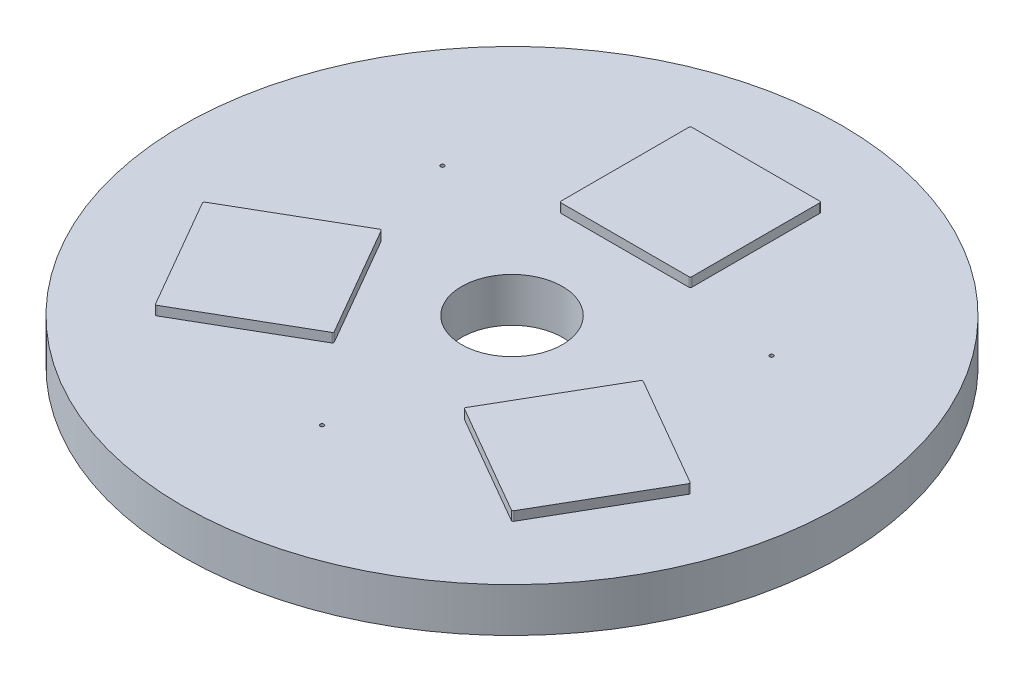
from build123d import *

# Parameters (mm, degrees)
SKETCH1_R            = 26.1
BOSS_EXTRUDE1_DEPTH  = 1.74625
SKETCH3_R            = 0.153555
SKETCH3_R_2          = 3.9925
CUT_EXTRUDE1_DEPTH   = 37.95225824
CIRPATTERN1_COUNT    = 3
BOSS_EXTRUDE2_DEPTH  = 0.727604167
CIRPATTERN2_COUNT    = 3
MIRROR1_COPY_1_DEPTH = 0.727604167
MIRROR1_COPY_2_DEPTH = 0.727604167


with BuildPart() as part:
    # Sketch1 → Boss-Extrude1 (new, symmetric)
    with BuildSketch(Plane(origin=(0, 0, 0), x_dir=(1, 0, 0), z_dir=(0, 1, 0))):
        with Locations(Location((0, 0, 0), (0, 0, 270))):
            Circle(SKETCH1_R)
    extrude(amount=BOSS_EXTRUDE1_DEPTH, both=True)

    # Sketch3 → Cut-Extrude1 (cut, symmetric)
    with BuildSketch(Plane(origin=(0, 0, 0), x_dir=(1, 0, 0), z_dir=(0, 1, 0))):
        with Locations(Location((0, -15.04625, 0), (0, 0, 270))):
            Circle(SKETCH3_R)
        with Locations(Location((0, 0, 0), (0, 0, 270))):
            Circle(SKETCH3_R_2)
    cut_extrude1 = extrude(amount=CUT_EXTRUDE1_DEPTH, both=True, mode=Mode.SUBTRACT)

    # CirPattern1: Cut-Extrude1 ×3 about axis
    cirpattern1_axis = Axis((0, 0, 0), (0, 1, 0))
    for i in range(1, CIRPATTERN1_COUNT):
        add(cut_extrude1.rotate(cirpattern1_axis, i * 360 / CIRPATTERN1_COUNT), mode=Mode.SUBTRACT)

    # Sketch5 → Boss-Extrude2 (add)
    with BuildSketch(Plane(origin=(0, 1.74625, 0), x_dir=(1, 0, 0), z_dir=(0, 1, 0))):
        with BuildLine():
            Line((-10.437704598, -0.043193858), (-19.210591569, -5.108222512))
            ThreePointArc((-19.210591569, -5.108222512), (-19.2648331, -5.178911453), (-19.253203026, -5.267250636))
            Line((-19.253203026, -5.267250636), (-14.188174372, -14.040137607))
            ThreePointArc((-14.188174372, -14.040137607), (-14.117485432, -14.094379138), (-14.029146248, -14.082749064))
            Line((-14.029146248, -14.082749064), (-5.256259278, -9.01772041))
            ThreePointArc((-5.256259278, -9.01772041), (-5.202017746, -8.94703147), (-5.21364782, -8.858692286))
            Line((-5.21364782, -8.858692286), (-10.278676474, -0.085805316))
            ThreePointArc((-10.278676474, -0.085805316), (-10.349365415, -0.031563784), (-10.437704598, -0.043193858))
        make_face()
    boss_extrude2 = extrude(amount=BOSS_EXTRUDE2_DEPTH)

    # CirPattern2: Boss-Extrude2 ×3 about axis
    cirpattern2_axis = Axis((0, 0, 0), (0, 1, 0))
    for i in range(1, CIRPATTERN2_COUNT):
        add(boss_extrude2.rotate(cirpattern2_axis, i * 360 / CIRPATTERN2_COUNT))

    # Mirror1: Boss-Extrude2 across plane
    add(boss_extrude2.mirror(Plane.ZX))

    # Mirror1 copy 1 sketch → Mirror1 copy 1 (add)
    with BuildSketch(Plane(origin=(0, -1.74625, 0), x_dir=(-0.4999999999999998, 0, -0.8660254037844387), z_dir=(0, -1, 0))):
        with BuildLine():
            Line((-10.437704598, 0.043193858), (-19.210591569, 5.108222512))
            ThreePointArc((-19.210591569, 5.108222512), (-19.2648331, 5.178911453), (-19.253203026, 5.267250636))
            Line((-19.253203026, 5.267250636), (-14.188174372, 14.040137607))
            ThreePointArc((-14.188174372, 14.040137607), (-14.117485432, 14.094379138), (-14.029146248, 14.082749064))
            Line((-14.029146248, 14.082749064), (-5.256259278, 9.01772041))
            ThreePointArc((-5.256259278, 9.01772041), (-5.202017746, 8.94703147), (-5.21364782, 8.858692286))
            Line((-5.21364782, 8.858692286), (-10.278676474, 0.085805316))
            ThreePointArc((-10.278676474, 0.085805316), (-10.349365415, 0.031563784), (-10.437704598, 0.043193858))
        make_face()
    extrude(amount=MIRROR1_COPY_1_DEPTH)

    # Mirror1 copy 2 sketch → Mirror1 copy 2 (add)
    with BuildSketch(Plane(origin=(0, -1.74625, 0), x_dir=(-0.5000000000000004, 0, 0.8660254037844384), z_dir=(0, -1, 0))):
        with BuildLine():
            Line((-10.437704598, 0.043193858), (-19.210591569, 5.108222512))
            ThreePointArc((-19.210591569, 5.108222512), (-19.2648331, 5.178911453), (-19.253203026, 5.267250636))
            Line((-19.253203026, 5.267250636), (-14.188174372, 14.040137607))
            ThreePointArc((-14.188174372, 14.040137607), (-14.117485432, 14.094379138), (-14.029146248, 14.082749064))
            Line((-14.029146248, 14.082749064), (-5.256259278, 9.01772041))
            ThreePointArc((-5.256259278, 9.01772041), (-5.202017746, 8.94703147), (-5.21364782, 8.858692286))
            Line((-5.21364782, 8.858692286), (-10.278676474, 0.085805316))
            ThreePointArc((-10.278676474, 0.085805316), (-10.349365415, 0.031563784), (-10.437704598, 0.043193858))
        make_face()
    extrude(amount=MIRROR1_COPY_2_DEPTH)


solid = part.part
